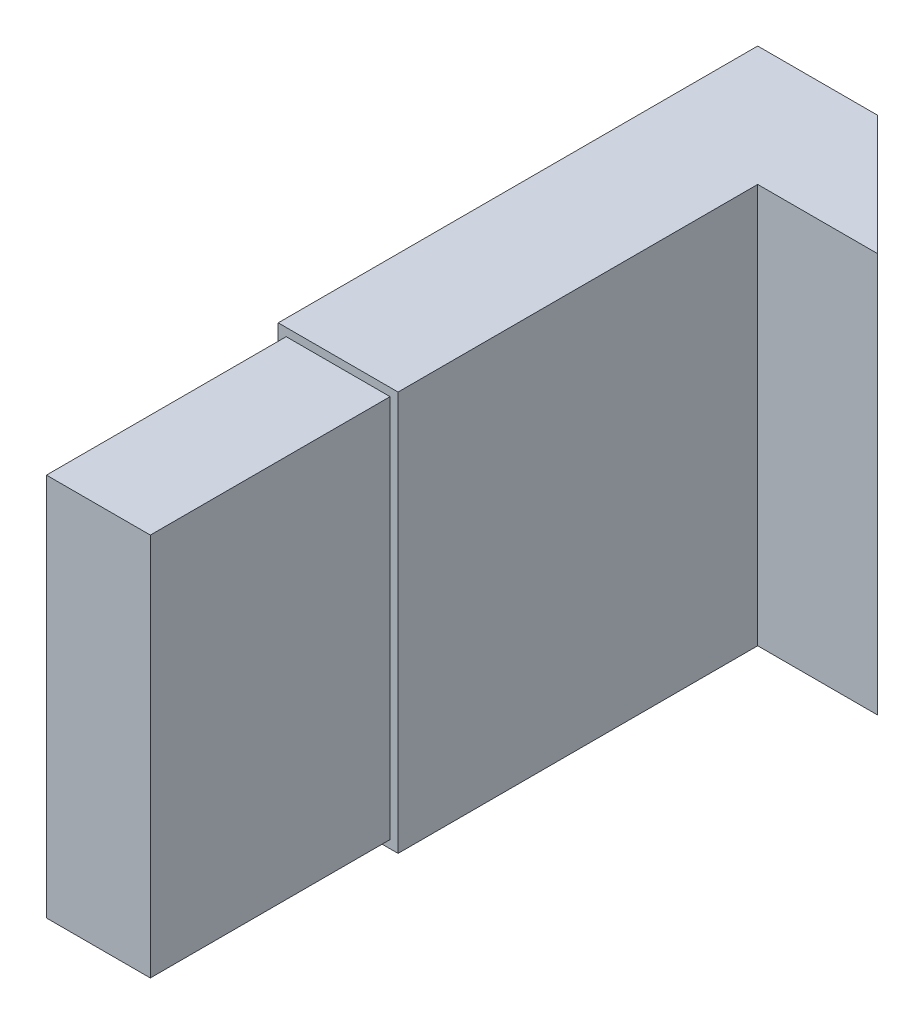
from build123d import *

# Parameters (mm, degrees)
BOSS_EXTRUDE1_DEPTH = 5
SKETCH2_W           = 1.3
SKETCH2_H           = 4.8
BOSS_EXTRUDE2_DEPTH = 3


with BuildPart() as part:
    # Sketch1 → Boss-Extrude1 (new body)
    with BuildSketch(Plane(origin=(0, 0, 0), x_dir=(1, 0, 0), z_dir=(0, 1, 0))):
        Polygon((0.75, 1.5), (2.25, 1.5), (0.75, 3), (-0.75, 3), (-0.75, -3), (-0.7, -3), (0.7, -3), (0.75, -3), align=None)
    extrude(amount=BOSS_EXTRUDE1_DEPTH)

    # Sketch2 → Boss-Extrude2 (add)
    with BuildSketch(Plane.XY.offset(3)):
        with Locations((0, 2.5)):
            Rectangle(SKETCH2_W, SKETCH2_H)
    extrude(amount=BOSS_EXTRUDE2_DEPTH)


solid = part.part
